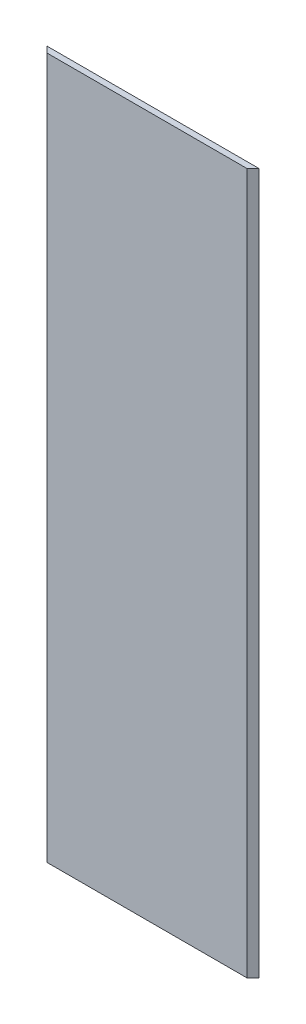
from build123d import *

# Parameters (mm, degrees)
SKETCH1_W           = 350
SKETCH1_H           = 100
BOSS_EXTRUDE1_DEPTH = 3
BOSS_EXTRUDE2_DEPTH = 350


with BuildPart() as part:
    # Sketch1 → Boss-Extrude1 (new body)
    with BuildSketch(Plane(origin=(0, 0, 0), x_dir=(0, 1, 0), z_dir=(0, 0, 1))):
        Rectangle(SKETCH1_W, SKETCH1_H)
    extrude(amount=BOSS_EXTRUDE1_DEPTH)

    # Sketch2 → Boss-Extrude2 (add, through all)
    with BuildSketch(Plane.XZ.offset(175)):
        Polygon((-50, 3), (-50, 0), (-53, 0), align=None)
        Polygon((50, 3), (53, 0), (50, 0), align=None)
    extrude(amount=-BOSS_EXTRUDE2_DEPTH)


solid = part.part
